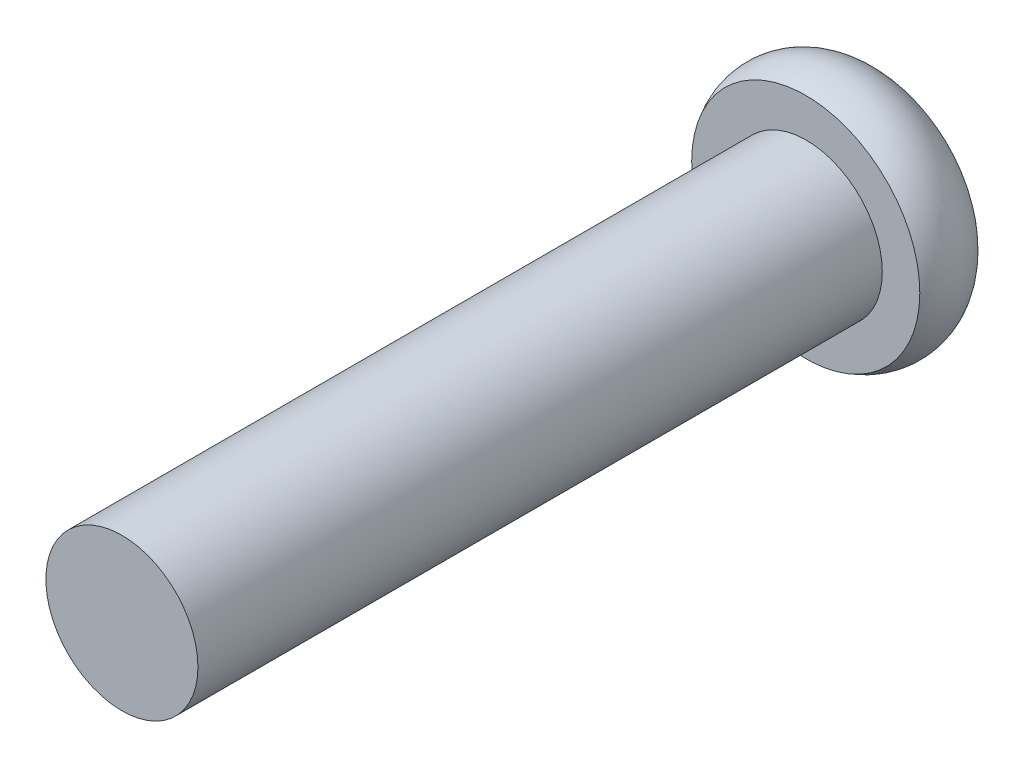
from build123d import *

# Parameters (mm, degrees)
CUT_EXTRUDE1_DEPTH  = 2
CUT_EXTRUDE1_DRAFT  = -12
SKETCH3_R           = 2
BOSS_EXTRUDE1_DEPTH = 18


with BuildPart() as part:
    # Sketch1 → Revolve2 (revolve)
    with BuildSketch(Plane(origin=(0, 0, 0), x_dir=(1, 0, 0), z_dir=(0, 1, 0))):
        with BuildLine():
            Line((0, 0), (0, 2))
            Line((0, 2), (2.298285661, 2))
            ThreePointArc((2.298285661, 2), (2.441964308, 1.978911731), (2.57352322, 1.917425786))
            ThreePointArc((2.57352322, 1.917425786), (3.174697589, 1.044998208), (3, 0))
            Line((3, 0), (0, 0))
        make_face()
    revolve(axis=Axis((0, 0, -0.65925001), (0, 0, -1)))


with BuildPart() as cut_extrude1_tool:
    # Sketch2 → Cut-Extrude1 (with draft: the straight prism first)
    with BuildSketch(Plane(origin=(0, 0, -2), x_dir=(-1, 0, 0), z_dir=(0, 0, -1))):
        Polygon((0.5, -0.5), (2, -0.5), (2, 0.5), (0.5, 0.5), (0.5, 2), (-0.5, 2), (-0.5, 0.5), (-2, 0.5), (-2, -0.5), (-0.5, -0.5), (-0.5, -2), (0.5, -2), align=None)
    extrude(amount=-CUT_EXTRUDE1_DEPTH)
    # Cut-Extrude1: the draft: its side faces are tilted about the plane it starts from
    cut_extrude1_sides = [cut_extrude1_tool.faces().sort_by_distance(p)[0] for p in [
        (-1.25, -0.5, -1),
        (-2, 0, -1),
        (-1.25, 0.5, -1),
        (-0.5, 1.25, -1),
        (0, 2, -1),
        (0.5, 1.25, -1),
        (1.25, 0.5, -1),
        (2, 0, -1),
        (1.25, -0.5, -1),
        (0.5, -1.25, -1),
        (0, -2, -1),
        (-0.5, -1.25, -1),
    ]]
    draft(cut_extrude1_sides, Plane(origin=(0, 0, -2), x_dir=(-1, 0, 0), z_dir=(0, 0, -1)), CUT_EXTRUDE1_DRAFT)


with BuildPart() as part_1:
    add(part.part)

    # Cut-Extrude1: cut by cut_extrude1_tool
    add(cut_extrude1_tool.part, mode=Mode.SUBTRACT)

    # Sketch3 → Boss-Extrude1 (add)
    with BuildSketch(Plane.XY):
        with Locations((0.013589602, -0.013589602)):
            Circle(SKETCH3_R)
    extrude(amount=BOSS_EXTRUDE1_DEPTH)


solid = part_1.part
